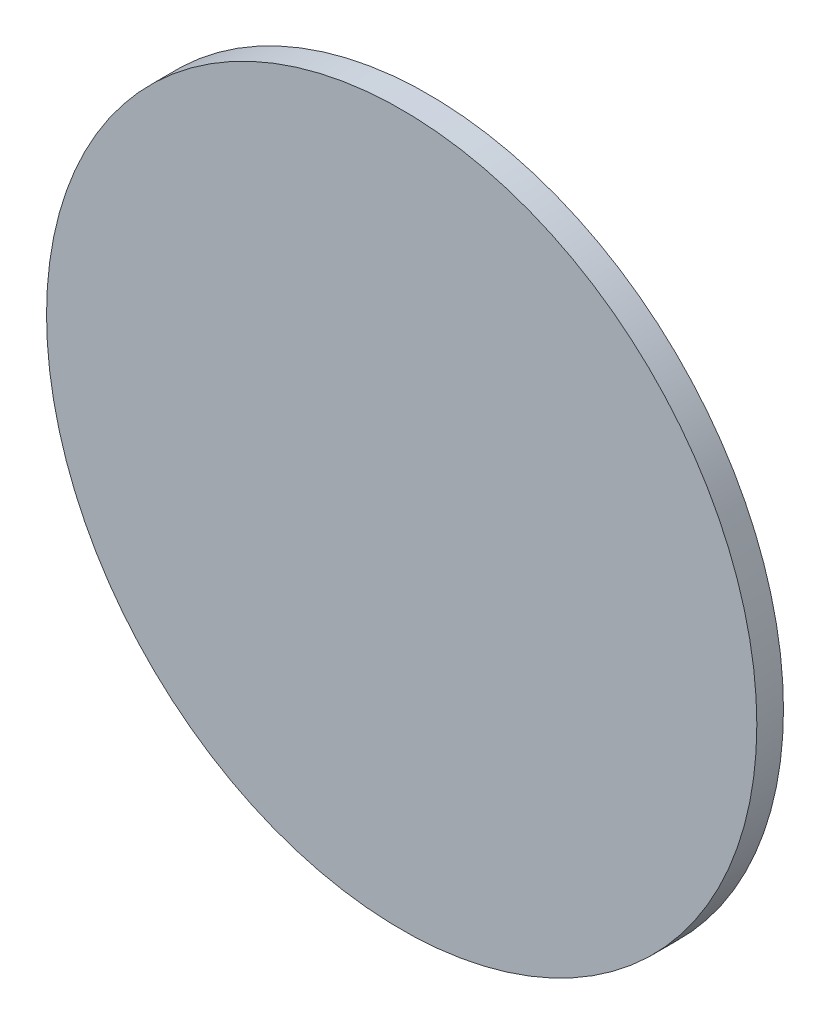
from build123d import *

# Parameters (mm, degrees)
ESQUISSE1_R        = 80
BOSS_EXTRU_1_DEPTH = 6


with BuildPart() as part:
    # Esquisse1 → Boss.-Extru.1 (new body)
    with BuildSketch(Plane.XY):
        Circle(ESQUISSE1_R)
    extrude(amount=BOSS_EXTRU_1_DEPTH)


solid = part.part
